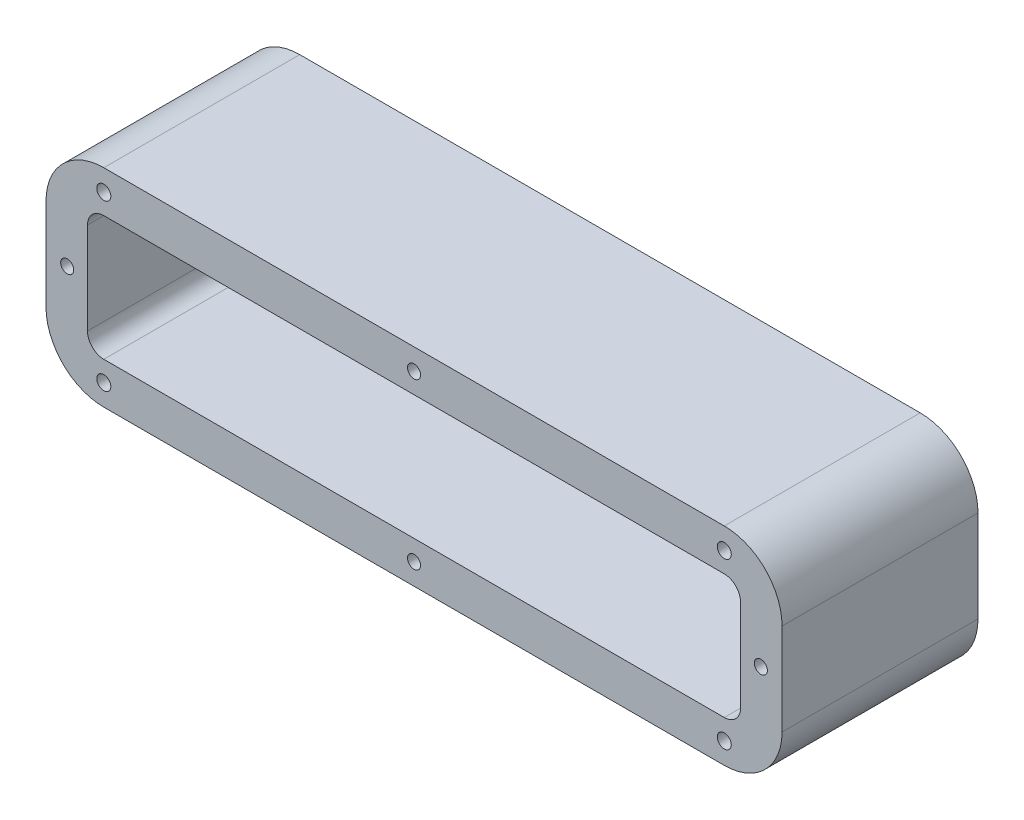
from build123d import *

# Parameters (mm, degrees)
ESQUISSE1_R        = 2
ESQUISSE1_R_2      = 2.146897886
BOSS_EXTRU_1_DEPTH = 60


with BuildPart() as part:
    # Esquisse1 → Boss.-Extru.1 (new body)
    with BuildSketch(Plane.XY):
        with BuildLine():
            Line((-95, -31.75), (95, -31.75))
            ThreePointArc((95, -31.75), (107.515790027, -26.565790027), (112.7, -14.05))
            Line((112.7, -14.05), (112.7, 14.05))
            ThreePointArc((112.7, 14.05), (107.515790027, 26.565790027), (95, 31.75))
            Line((95, 31.75), (-95, 31.75))
            ThreePointArc((-95, 31.75), (-107.515790027, 26.565790027), (-112.7, 14.05))
            Line((-112.7, 14.05), (-112.7, -14.05))
            ThreePointArc((-112.7, -14.05), (-107.515790027, -26.565790027), (-95, -31.75))
        make_face()
        with Locations((-106.2, 0)):
            Circle(ESQUISSE1_R, mode=Mode.SUBTRACT)
        with Locations((0, 25.25)):
            Circle(ESQUISSE1_R, mode=Mode.SUBTRACT)
        with Locations((-95, 25.25)):
            Circle(ESQUISSE1_R_2, mode=Mode.SUBTRACT)
        with Locations(Location((-95, -25.25, 0), (0, 0, 180))):
            Circle(ESQUISSE1_R_2, mode=Mode.SUBTRACT)
        with Locations(Location((0, -25.25, 0), (0, 0, 180))):
            Circle(ESQUISSE1_R, mode=Mode.SUBTRACT)
        with Locations((95, -25.25)):
            Circle(ESQUISSE1_R_2, mode=Mode.SUBTRACT)
        with Locations(Location((106.2, 0, 0), (0, 0, 180))):
            Circle(ESQUISSE1_R, mode=Mode.SUBTRACT)
        with Locations(Location((95, 25.25, 0), (0, 0, 180))):
            Circle(ESQUISSE1_R_2, mode=Mode.SUBTRACT)
        with BuildLine():
            Line((-95, -19.05), (95, -19.05))
            ThreePointArc((95, -19.05), (98.535533906, -17.585533906), (100, -14.05))
            Line((100, -14.05), (100, 14.05))
            ThreePointArc((100, 14.05), (98.535533906, 17.585533906), (95, 19.05))
            Line((95, 19.05), (-95, 19.05))
            ThreePointArc((-95, 19.05), (-98.535533906, 17.585533906), (-100, 14.05))
            Line((-100, 14.05), (-100, -14.05))
            ThreePointArc((-100, -14.05), (-98.535533906, -17.585533906), (-95, -19.05))
        make_face(mode=Mode.SUBTRACT)
    extrude(amount=BOSS_EXTRU_1_DEPTH)


solid = part.part
